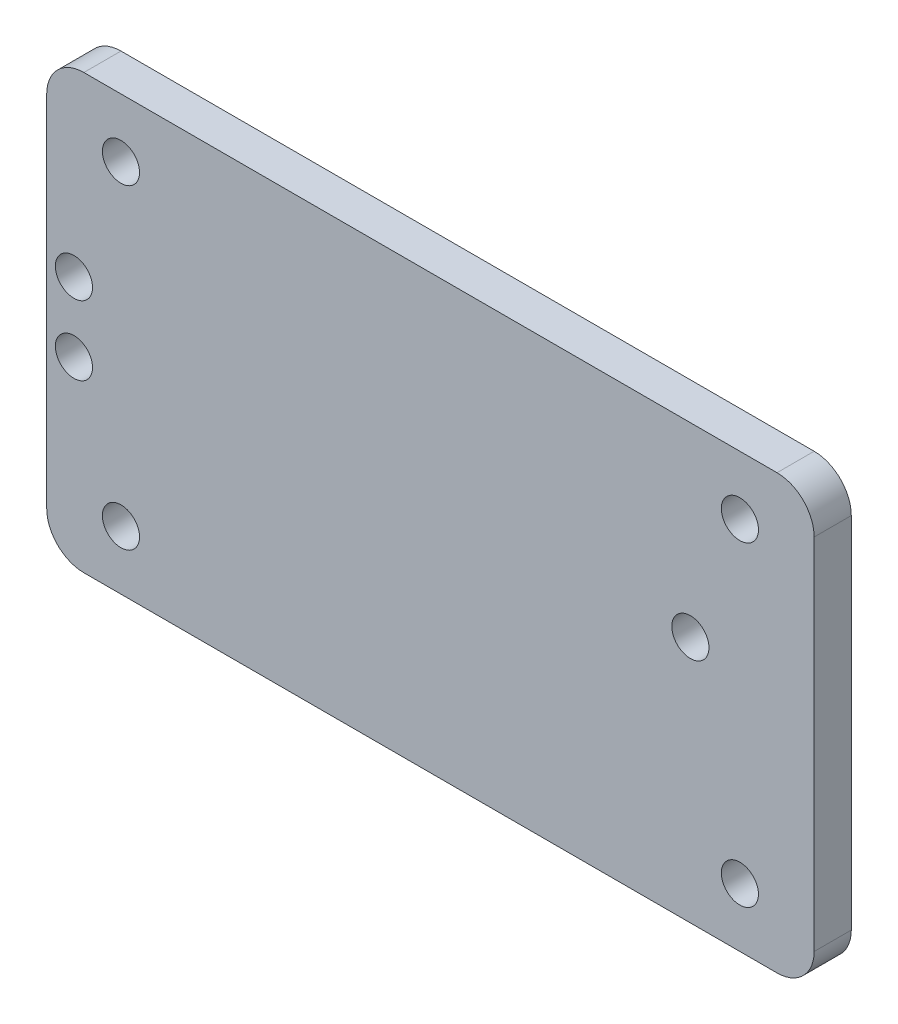
from build123d import *

# Parameters (mm, degrees)
SKETCH1_R           = 1.5
BOSS_EXTRUDE1_DEPTH = 3


with BuildPart() as part:
    # Sketch1 → Boss-Extrude1 (new body)
    with BuildSketch(Plane.XY):
        with BuildLine():
            Line((-28, 17.5), (28, 17.5))
            ThreePointArc((28, 17.5), (30.121320344, 16.621320344), (31, 14.5))
            Line((31, 14.5), (31, -14.5))
            ThreePointArc((31, -14.5), (30.121320344, -16.621320344), (28, -17.5))
            Line((28, -17.5), (-28, -17.5))
            ThreePointArc((-28, -17.5), (-30.121320344, -16.621320344), (-31, -14.5))
            Line((-31, -14.5), (-31, 14.5))
            ThreePointArc((-31, 14.5), (-30.121320344, 16.621320344), (-28, 17.5))
        make_face()
        with Locations((-28.8, 2.8)):
            Circle(SKETCH1_R, mode=Mode.SUBTRACT)
        with Locations((-28.8, -2.8)):
            Circle(SKETCH1_R, mode=Mode.SUBTRACT)
        with Locations((21, 2.5)):
            Circle(SKETCH1_R, mode=Mode.SUBTRACT)
        with Locations((-25, 12.75)):
            Circle(SKETCH1_R, mode=Mode.SUBTRACT)
        with Locations((25, 12.75)):
            Circle(SKETCH1_R, mode=Mode.SUBTRACT)
        with Locations((25, -12.75)):
            Circle(SKETCH1_R, mode=Mode.SUBTRACT)
        with Locations((-25, -12.75)):
            Circle(SKETCH1_R, mode=Mode.SUBTRACT)
    extrude(amount=BOSS_EXTRUDE1_DEPTH)


solid = part.part
